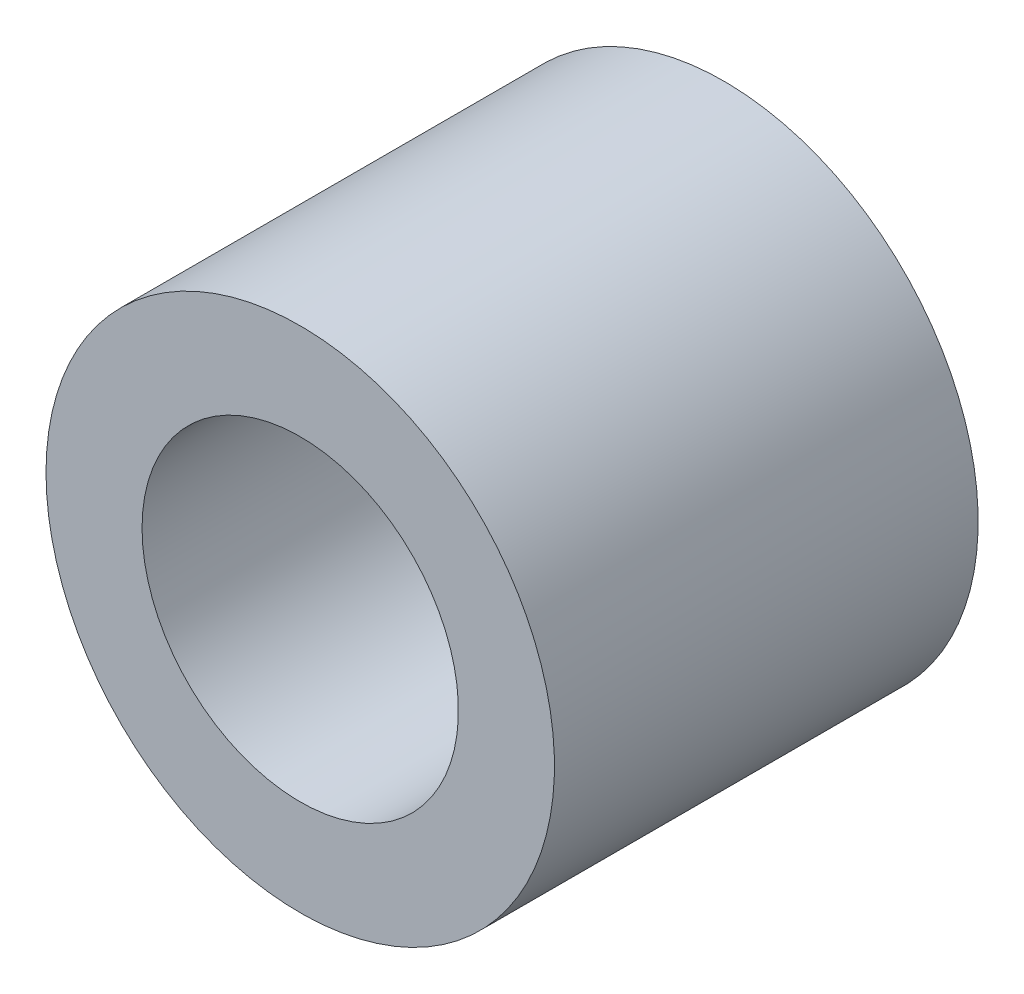
from build123d import *

# Parameters (mm, degrees)
SKETCH1_R           = 5.715
SKETCH1_R_2         = 3.556
BOSS_EXTRUDE1_DEPTH = 9.525


with BuildPart() as part:
    # Sketch1 → Boss-Extrude1 (new body)
    with BuildSketch(Plane.XY):
        with Locations(Location((0, 0, 0), (0, 0, 180))):
            Circle(SKETCH1_R)
        with Locations(Location((0, 0, 0), (0, 0, 180))):
            Circle(SKETCH1_R_2, mode=Mode.SUBTRACT)
    extrude(amount=BOSS_EXTRUDE1_DEPTH)


solid = part.part
